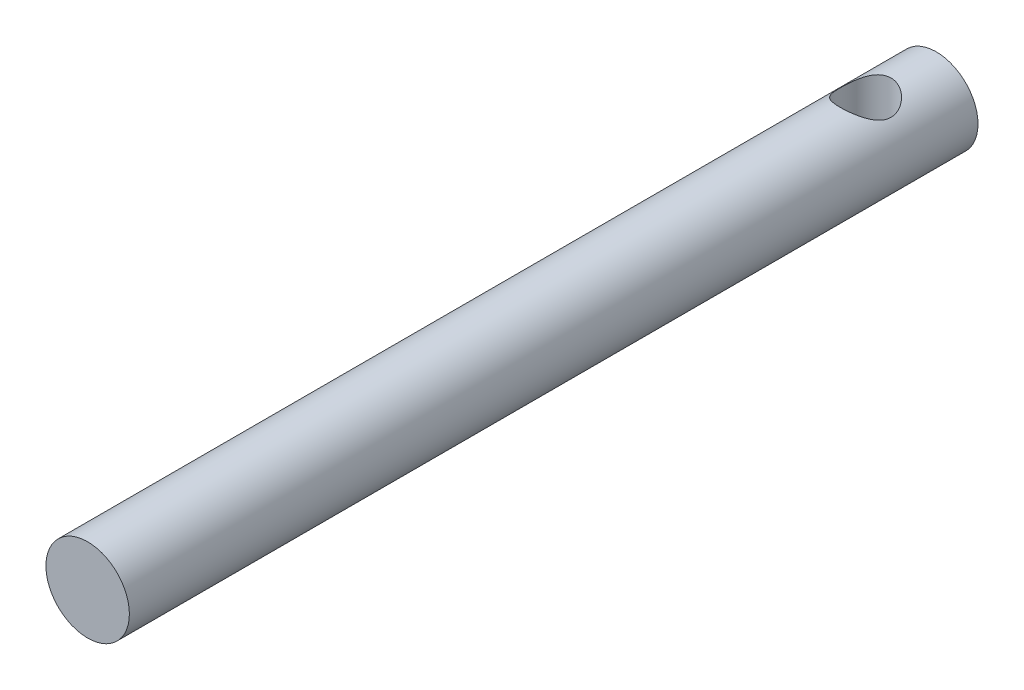
from build123d import *

# Parameters (mm, degrees)
SKETCH1_R               = 1.475
BOSS_EXTRUDE1_DEPTH     = 30
CUT_EXTRUDE1_DEPTH      = 10
CUT_EXTRUDE1_DEPTH_BACK = 10
SKETCH2_R               = 0.9


with BuildPart() as part:
    # Sketch1 → Boss-Extrude1 (new body)
    with BuildSketch(Plane.XY):
        Circle(SKETCH1_R)
    extrude(amount=BOSS_EXTRUDE1_DEPTH)

    # Sketch2 → Cut-Extrude1 (cut, two sides: drawn at the far end of the back side and taken through both)
    with BuildSketch(Plane(origin=(0, 0, 0), x_dir=(1, 0, 0), z_dir=(0, 1, 0)).offset(-CUT_EXTRUDE1_DEPTH_BACK)):
        with Locations((0, -2.5)):
            Circle(SKETCH2_R)
    extrude(amount=CUT_EXTRUDE1_DEPTH + CUT_EXTRUDE1_DEPTH_BACK, mode=Mode.SUBTRACT)


solid = part.part
